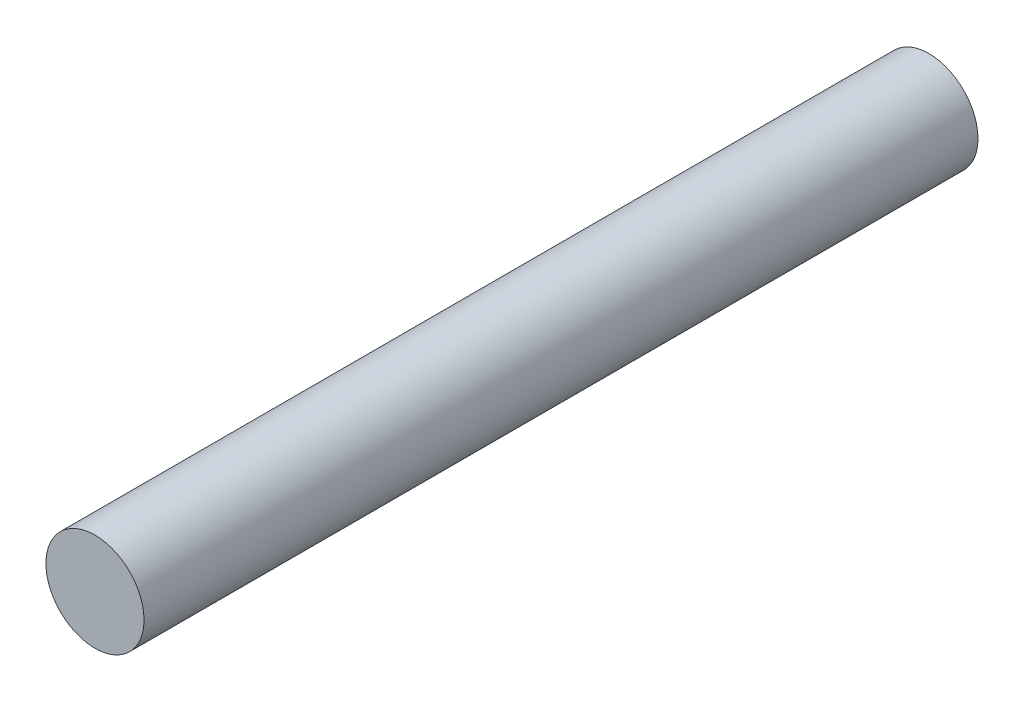
from build123d import *

# Parameters (mm, degrees)
SKETCH3_R           = 2
BOSS_EXTRUDE1_DEPTH = 34


with BuildPart() as part:
    # Sketch3 → Boss-Extrude1 (new body)
    with BuildSketch(Plane.XY):
        Circle(SKETCH3_R)
    extrude(amount=BOSS_EXTRUDE1_DEPTH)


solid = part.part
